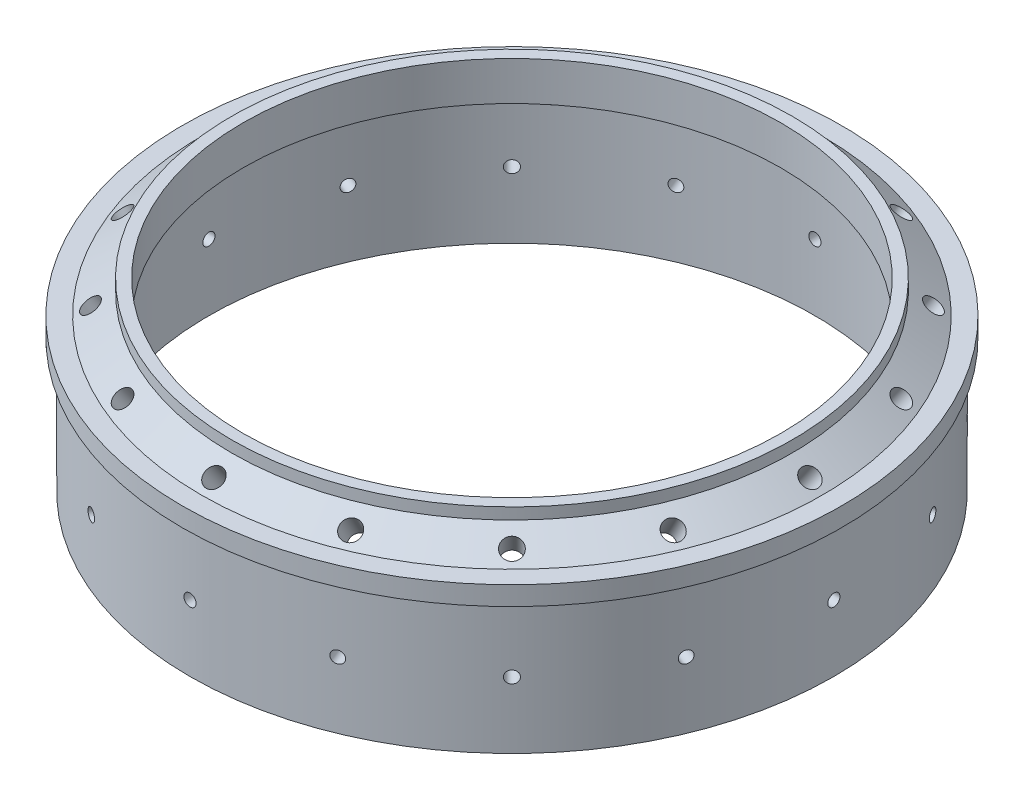
from build123d import *

# Parameters (mm, degrees)
F_4_2MM_DOWEL_HOLE1_D   = 5
CIRPATTERN1_COUNT       = 16
CUT_EXTRUDE1_REACH      = 198.657
CUT_EXTRUDE1_END_RADIUS = 80
SKETCH4_R               = 1.6
CIRPATTERN3_COUNT       = 16


with BuildPart() as part:
    # Sketch1 → Revolve1 (revolve)
    with BuildSketch(Plane.XY, mode=Mode.PRIVATE) as revolve1_sk:
        Polygon((-87, 0), (-87, -4), (-85, -4), (-85, -39), (-80, -39), (-80, -7), (-71, -0.698132156), (-71, 9.601660306), (-74, 9.601660306), (-74, 6.601660306), (-82, 1), (-87, 1), align=None)
    revolve(revolve1_sk.sketch.rotate(Axis((0, 0, 0), (0, -1, 0)), 270), axis=Axis((0, 0, 0), (0, -1, 0)))

    # Ø4.2mm Dowel Hole1 (through all)
    with Locations(Plane(origin=(-78.671010072, 3.330983842, 0), x_dir=(0.819152044289, 0.573576436351, 0), z_dir=(-0.573576436351, 0.819152044289, 0))):
        with Locations((1e-09, 0)):
            f_4_2mm_dowel_hole1 = Hole(F_4_2MM_DOWEL_HOLE1_D / 2)

    # CirPattern1: Ø4.2mm Dowel Hole1 ×16 about axis
    cirpattern1_axis = Axis((0, 6.601660306, 0), (0, -1, 0))
    for i in range(1, CIRPATTERN1_COUNT):
        add(f_4_2mm_dowel_hole1.rotate(cirpattern1_axis, i * 360 / CIRPATTERN1_COUNT), mode=Mode.SUBTRACT)

    # Cut-Extrude1: up to this cylinder (the profile starts outside it)
    cut_extrude1_end = Plane(origin=(0, -21.5, 0), z_dir=(0, 1, 0)) * Cylinder(CUT_EXTRUDE1_END_RADIUS, 558.314, mode=Mode.PRIVATE)
    # Sketch4 → Cut-Extrude1 (cut, up to the surface)
    with BuildSketch(Plane(origin=(0, 0, -85), x_dir=(-1, 0, 0), z_dir=(0, 0, -1)), mode=Mode.PRIVATE) as cut_extrude1_sk1:
        with Locations((0, -21.5)):
            Circle(SKETCH4_R)
    cut_extrude1_tool1 = extrude(cut_extrude1_sk1.sketch, amount=-CUT_EXTRUDE1_REACH, mode=Mode.PRIVATE) - cut_extrude1_end
    cut_extrude1 = cut_extrude1_tool1.solids().sort_by_distance((0, -21.5, -85))[0]
    add(cut_extrude1, mode=Mode.SUBTRACT)

    # CirPattern3: Cut-Extrude1 ×16 about axis
    cirpattern3_axis = Axis((0, 0, 0), (0, -1, 0))
    for i in range(1, CIRPATTERN3_COUNT):
        add(cut_extrude1.rotate(cirpattern3_axis, i * 360 / CIRPATTERN3_COUNT), mode=Mode.SUBTRACT)


solid = part.part
